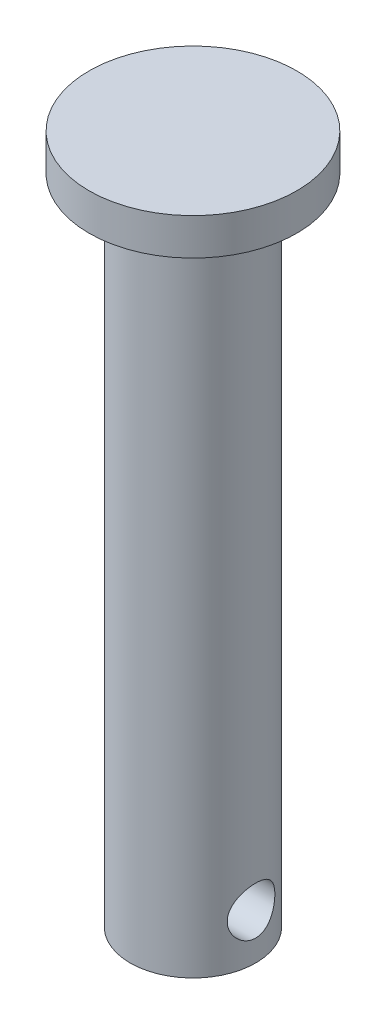
from build123d import *

# Parameters (mm, degrees)
SKETCH1_R               = 2.9
BOSS_EXTRUDE1_DEPTH     = 30.15
SKETCH2_R               = 4.8
BOSS_EXTRUDE2_DEPTH     = 1.7
CUT_EXTRUDE1_DEPTH      = 31.904732647
CUT_EXTRUDE1_DEPTH_BACK = 31.904732647
SKETCH3_R               = 1.1


with BuildPart() as part:
    # Sketch1 → Boss-Extrude1 (new body)
    with BuildSketch(Plane(origin=(0, 0, 0), x_dir=(1, 0, 0), z_dir=(0, 1, 0))):
        with Locations(Location((0, 0, 0), (0, 0, 270))):
            Circle(SKETCH1_R)
    extrude(amount=-BOSS_EXTRUDE1_DEPTH)

    # Sketch2 → Boss-Extrude2 (add)
    with BuildSketch(Plane(origin=(0, 0, 0), x_dir=(1, 0, 0), z_dir=(0, 1, 0))):
        with Locations(Location((0, 0, 0), (0, 0, 270))):
            Circle(SKETCH2_R)
    extrude(amount=BOSS_EXTRUDE2_DEPTH)

    # Sketch3 → Cut-Extrude1 (cut, two sides: drawn at the far end of the back side and taken through both)
    with BuildSketch(Plane(origin=(0, 0, 0), x_dir=(0, 0, -1), z_dir=(1, 0, 0)).offset(-CUT_EXTRUDE1_DEPTH_BACK)):
        with Locations((0, -28.05)):
            Circle(SKETCH3_R)
    extrude(amount=CUT_EXTRUDE1_DEPTH + CUT_EXTRUDE1_DEPTH_BACK, mode=Mode.SUBTRACT)


solid = part.part
